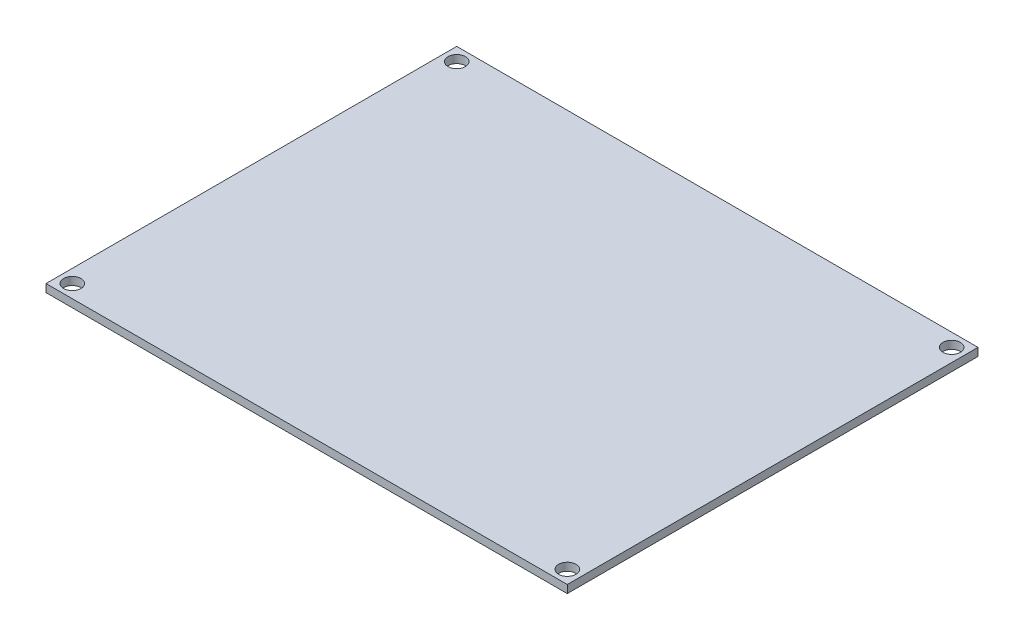
from build123d import *

# Parameters (mm, degrees)
SKETCH1_W           = 99
SKETCH1_H           = 78
BOSS_EXTRUDE1_DEPTH = 1.5
SKETCH2_R           = 1.65
CUT_EXTRUDE1_DEPTH  = 64.035704168


with BuildPart() as part:
    # Sketch1 → Boss-Extrude1 (new body)
    with BuildSketch(Plane(origin=(0, 0, 0), x_dir=(1, 0, 0), z_dir=(0, 1, 0))):
        Rectangle(SKETCH1_W, SKETCH1_H)
    extrude(amount=BOSS_EXTRUDE1_DEPTH)

    # Sketch2 → Cut-Extrude1 (cut, through all)
    with BuildSketch(Plane(origin=(0, 1.5, 0), x_dir=(1, 0, 0), z_dir=(0, 1, 0))):
        with Locations(Location((-47, 36.5, 0), (0, 0, 270))):
            Circle(SKETCH2_R)
        with Locations(Location((47, 36.5, 0), (0, 0, 270))):
            Circle(SKETCH2_R)
        with Locations(Location((47, -36.5, 0), (0, 0, 270))):
            Circle(SKETCH2_R)
        with Locations(Location((-47, -36.5, 0), (0, 0, 270))):
            Circle(SKETCH2_R)
    extrude(amount=-CUT_EXTRUDE1_DEPTH, mode=Mode.SUBTRACT)


solid = part.part
